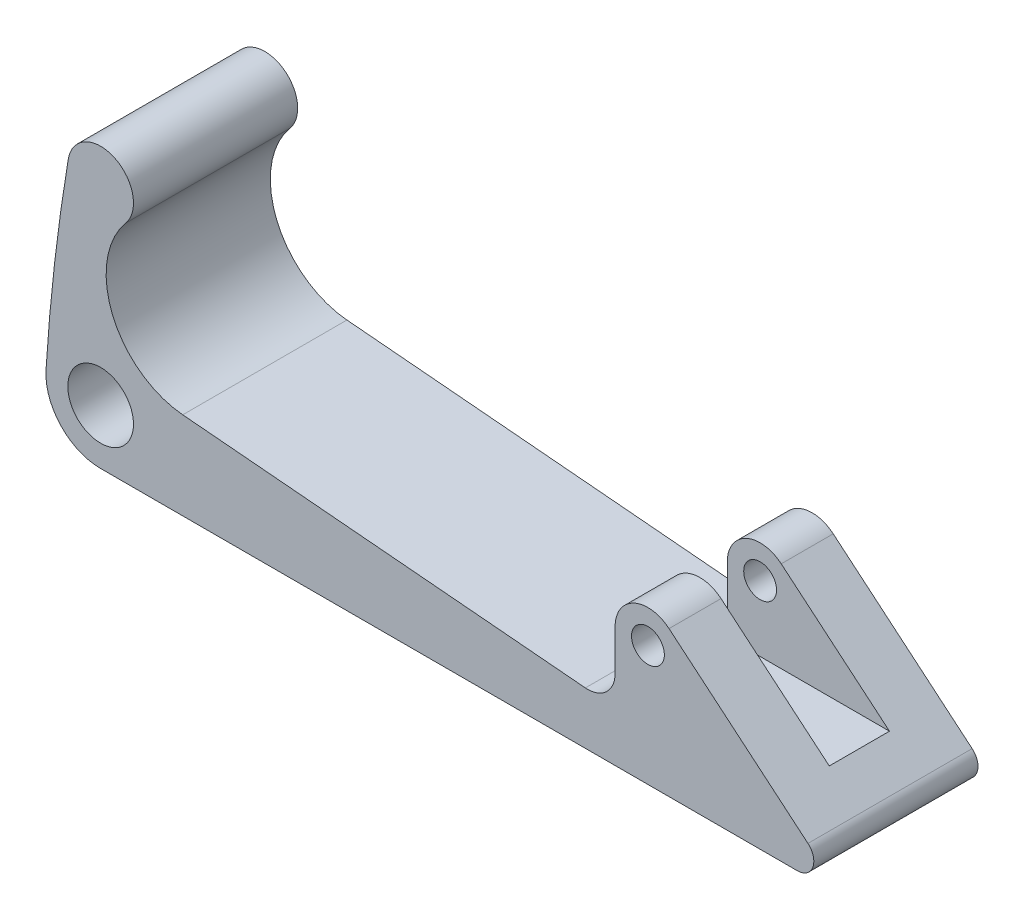
from build123d import *

# Parameters (mm, degrees)
SKETCH1_R           = 3
SKETCH1_R_2         = 1.5
BOSS_EXTRUDE1_DEPTH = 7.5
CUT_EXTRUDE1_REACH  = 70.715
SKETCH2_W           = 20.337315641
SKETCH2_H           = 5.5


with BuildPart() as part:
    # Sketch1 → Boss-Extrude1 (new, symmetric)
    with BuildSketch(Plane.XY):
        with BuildLine():
            Line((0, -5), (63.65524487, -5))
            ThreePointArc((63.65524487, -5), (65.064783801, -4.013030215), (64.619426284, -2.350933335))
            Line((64.619426284, -2.350933335), (51.928362829, 8.298133329))
            ThreePointArc((51.928362829, 8.298133329), (48.732145215, 8.718923361), (47, 6))
            Line((47, 6), (47, 2.272469043))
            ThreePointArc((47, 2.272469043), (46.188975519, 0.429275701), (44.282110643, -0.218017702))
            Line((44.282110643, -0.218017702), (7.5, 3))
            ThreePointArc((7.5, 3), (1.083445994, 7.70613076), (2.297102135, 15.570408909))
            ThreePointArc((2.297102135, 15.570408909), (1.25801786, 20.223488767), (-2.958378986, 17.997989735))
            ThreePointArc((-2.958378986, 17.997989735), (-4.206114513, 9.18048564), (-4.990396875, 0.30974026))
            ThreePointArc((-4.990396875, 0.30974026), (-3.643398228, -3.424273551), (0, -5))
        make_face()
        Circle(SKETCH1_R, mode=Mode.SUBTRACT)
        with Locations((50, 6)):
            Circle(SKETCH1_R_2, mode=Mode.SUBTRACT)
    extrude(amount=BOSS_EXTRUDE1_DEPTH, both=True)

    # Sketch2 → Cut-Extrude1 (cut, up to next)
    with BuildSketch(Plane(origin=(0, 0, 0), x_dir=(1, 0, 0), z_dir=(0, 1, 0)), mode=Mode.PRIVATE) as cut_extrude1_sk1:
        with Locations((54.450768463, 0)):
            Rectangle(SKETCH2_W, SKETCH2_H)
    cut_extrude1_tool1 = extrude(cut_extrude1_sk1.sketch, amount=CUT_EXTRUDE1_REACH, mode=Mode.PRIVATE) & part.part
    add(cut_extrude1_tool1.solids().sort_by_distance((54.450768, 0, 0))[0], mode=Mode.SUBTRACT)


solid = part.part
